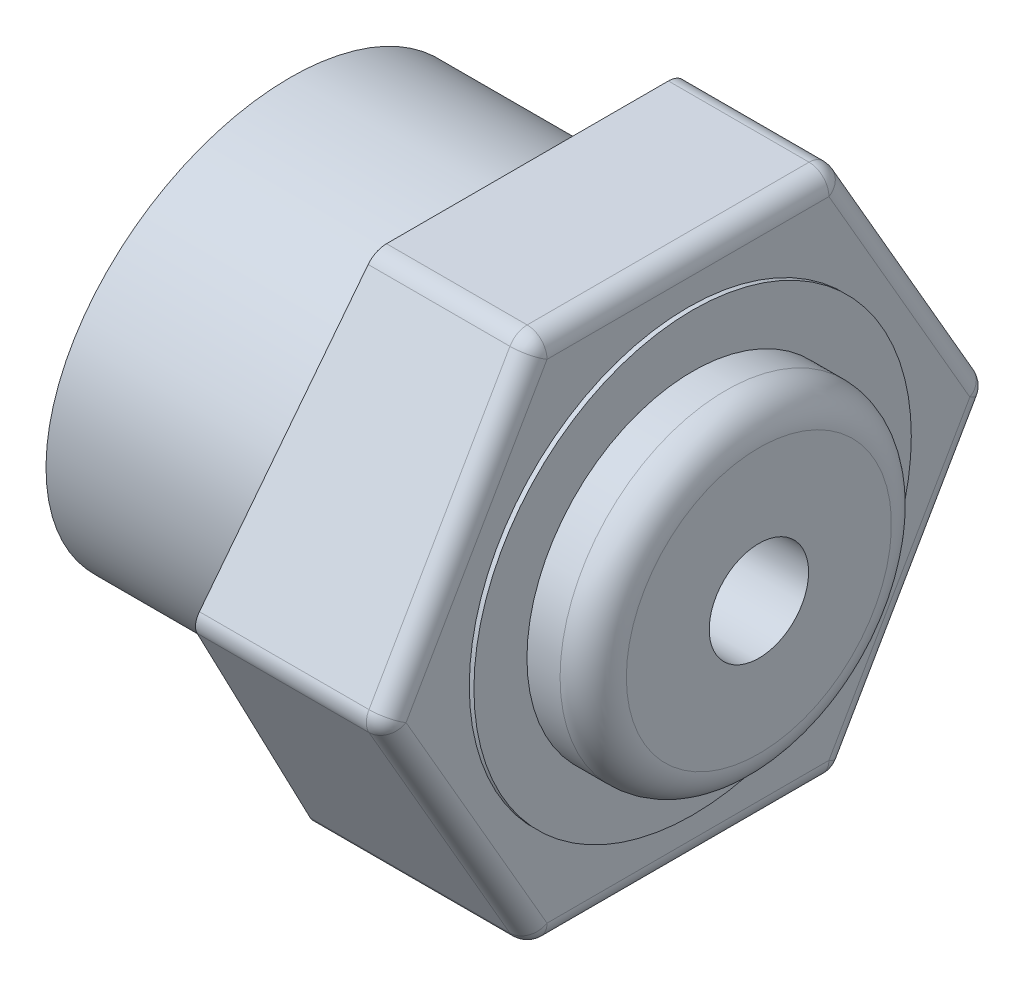
from build123d import *

# Parameters (mm, degrees)
SALIENTE_EXTRUIR1_DEPTH = 3.33
REDONDEO1_R             = 0.3
CORTAR_EXTRUIR3_DEPTH   = 9.95
CROQUIS2_R              = 3.3
SALIENTE_EXTRUIR4_DEPTH = 3.4
CROQUIS6_R              = 2.5
SALIENTE_EXTRUIR5_DEPTH = 7.8
REDONDEO3_R             = 0.5
CROQUIS7_R              = 0.75
CORTAR_EXTRUIR4_DEPTH   = 10.871432541
CORTAR_EXTRUIR5_DEPTH   = 3.9


with BuildPart() as part:
    # Croquis1 → Saliente-Extruir1 (new body)
    with BuildSketch(Plane(origin=(0, 0, 0), x_dir=(0, 0, -1), z_dir=(1, 0, 0))):
        Polygon((-4.6, 0), (-2.3, -3.983716857), (2.3, -3.983716857), (4.6, 0), (2.3, 3.983716857), (-2.3, 3.983716857), align=None)
    extrude(amount=SALIENTE_EXTRUIR1_DEPTH)

    # Redondeo1
    redondeo1_edges = [part.edges().sort_by_distance(p)[0] for p in [
        (1.665, 3.983716857, 2.3),
        (1.665, 3.983716857, -2.3),
        (1.665, 0, -4.6),
        (1.665, -3.983716857, -2.3),
        (1.665, -3.983716857, 2.3),
        (1.665, 0, 4.6),
        (3.33, -3.983716857, 0),
        (3.33, -1.991858429, -3.45),
        (3.33, 1.991858429, -3.45),
        (3.33, 3.983716857, 0),
        (3.33, 1.991858429, 3.45),
        (3.33, -1.991858429, 3.45),
    ]]
    fillet(redondeo1_edges, radius=REDONDEO1_R)

    # Croquis5 → Cortar-Extruir3 (cut, symmetric)
    with BuildSketch(Plane.XY):
        Polygon((0, -3.983716857), (-2.185194876, -3.983716857), (-2.185194876, 4.171179011), (0.929133021, 4.171179011), align=None)
    extrude(amount=CORTAR_EXTRUIR3_DEPTH, both=True, mode=Mode.SUBTRACT)

    # Croquis2 → Saliente-Extruir4 (add, symmetric)
    with BuildSketch(Plane.ZY):
        with Locations(Location((0, 0, 0), (0, 0, 90))):
            Circle(CROQUIS2_R)
    extrude(amount=SALIENTE_EXTRUIR4_DEPTH, both=True)

    # Croquis6 → Saliente-Extruir5 (add)
    with BuildSketch(Plane.ZY.offset(3.4)):
        Circle(CROQUIS6_R)
    extrude(amount=-SALIENTE_EXTRUIR5_DEPTH)

    # Redondeo3
    redondeo3_edges = [part.edges().sort_by_distance(p)[0] for p in [
        (4.4, 0, -2.5),
    ]]
    fillet(redondeo3_edges, radius=REDONDEO3_R)

    # Croquis7 → Cortar-Extruir4 (cut, through all)
    with BuildSketch(Plane(origin=(4.4, 0, 0), x_dir=(0, 0, -1), z_dir=(1, 0, 0))):
        Circle(CROQUIS7_R)
    extrude(amount=-CORTAR_EXTRUIR4_DEPTH, mode=Mode.SUBTRACT)

    # Croquis8 → Cortar-Extruir5 (cut, symmetric)
    with BuildSketch(Plane.XY):
        Polygon((-3.4, -3.3), (-2.582609663, 4.139540535), (-3.4, 4.139540535), align=None)
    extrude(amount=CORTAR_EXTRUIR5_DEPTH, both=True, mode=Mode.SUBTRACT)


solid = part.part
